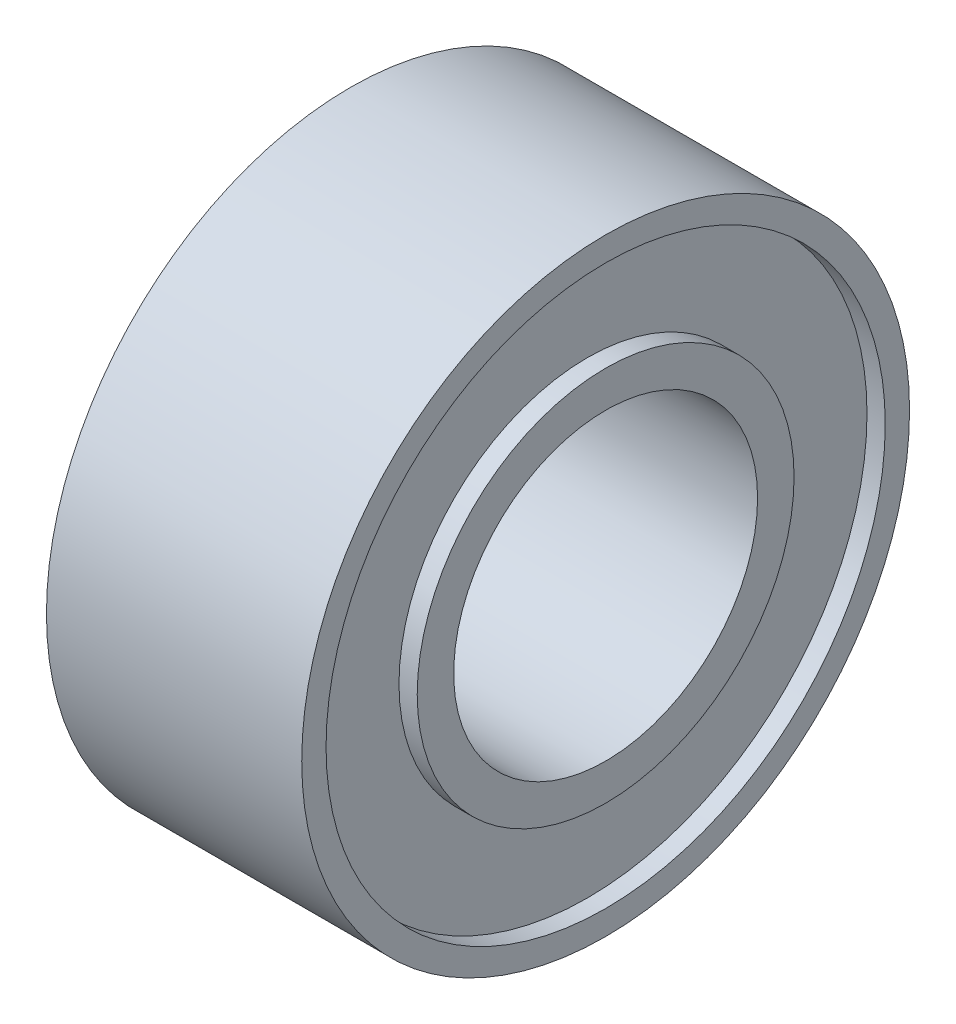
from build123d import *


with BuildPart() as part:
    # Sketch1 → Revolve1 (revolve)
    with BuildSketch(Plane.XY, mode=Mode.PRIVATE) as revolve1_sk:
        Polygon((-2.1, 3.1), (-2.1, 2.5), (2.1, 2.5), (2.1, 3.1), (1.8, 3.1), (1.8, 4.6), (2.1, 4.6), (2.1, 5), (-2.1, 5), (-2.1, 4.6), (-1.8, 4.6), (-1.8, 3.1), align=None)
    revolve(revolve1_sk.sketch.rotate(Axis((-2.1, 0, 0), (1, 0, 0)), 270), axis=Axis((-2.1, 0, 0), (1, 0, 0)))


solid = part.part
